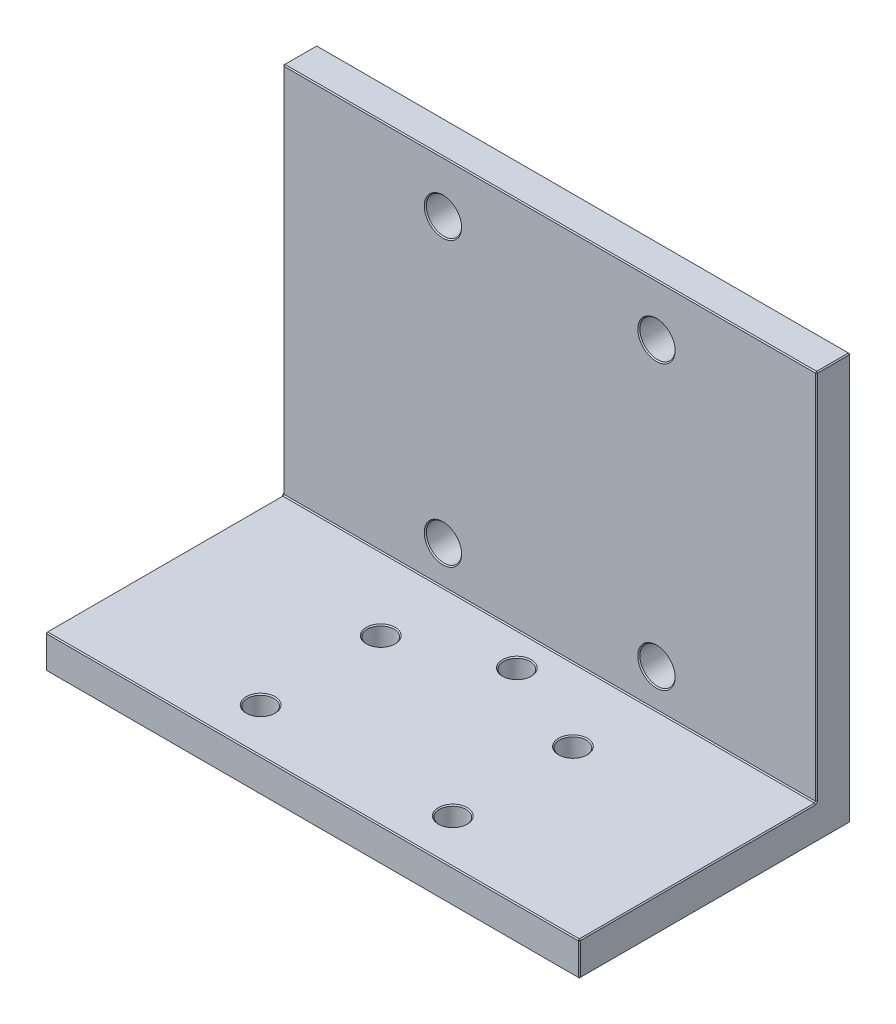
from build123d import *

# Parameters (mm, degrees)
BOSS_EXTRUDE1_DEPTH = 50
SKETCH2_R           = 3.3
CUT_EXTRUDE1_DEPTH  = 100
SKETCH3_R           = 2.5
CUT_EXTRUDE2_DEPTH  = 100
CHAMFER1_SIZE       = 0.2


with BuildPart() as part:
    # Sketch1 → Boss-Extrude1 (new, symmetric)
    with BuildSketch(Plane(origin=(0, 0, 0), x_dir=(0, 0, -1), z_dir=(1, 0, 0))):
        Polygon((0, 0), (0, 76.2), (-6.35, 76.2), (-6.35, 6.35), (-50.8, 6.35), (-50.8, 0), align=None)
    extrude(amount=BOSS_EXTRUDE1_DEPTH, both=True)

    # Sketch2 → Cut-Extrude1 (cut)
    with BuildSketch(Plane.XY.offset(6.35)):
        with Locations((-20, 66.5)):
            Circle(SKETCH2_R)
        with Locations((20, 66.5)):
            Circle(SKETCH2_R)
        with Locations((20, 13.5)):
            Circle(SKETCH2_R)
        with Locations((-20, 13.5)):
            Circle(SKETCH2_R)
    extrude(amount=-CUT_EXTRUDE1_DEPTH, mode=Mode.SUBTRACT)

    # Sketch3 → Cut-Extrude2 (cut)
    with BuildSketch(Plane(origin=(0, 6.35, 0), x_dir=(1, 0, 0), z_dir=(0, 1, 0))):
        with Locations(Location((-18, -20, 0), (0, 0, 270))):
            Circle(SKETCH3_R)
        with Locations(Location((-18, -42.5, 0), (0, 0, 270))):
            Circle(SKETCH3_R)
        with Locations(Location((18, -42.5, 0), (0, 0, 270))):
            Circle(SKETCH3_R)
        with Locations(Location((18, -20, 0), (0, 0, 270))):
            Circle(SKETCH3_R)
        with Locations(Location((0, -12.5, 0), (0, 0, 270))):
            Circle(SKETCH3_R)
    extrude(amount=-CUT_EXTRUDE2_DEPTH, mode=Mode.SUBTRACT)

    # Chamfer1
    chamfer1_edges = [part.edges().sort_by_distance(p)[0] for p in [
        (50, 76.2, 3.175),
        (0, 0, 50.8),
        (0, 6.35, 50.8),
        (0, 6.35, 6.35),
        (0, 76.2, 6.35),
        (0, 76.2, 0),
        (0, 0, 0),
        (50, 41.275, 6.35),
        (50, 6.35, 28.575),
        (50, 3.175, 50.8),
        (-23.3, 66.5, 0),
        (-23.3, 66.5, 6.35),
        (16.7, 66.5, 0),
        (16.7, 66.5, 6.35),
        (16.7, 13.5, 0),
        (16.7, 13.5, 6.35),
        (-23.3, 13.5, 0),
        (-23.3, 13.5, 6.35),
        (-18, 0, 17.5),
        (50, 0, 25.4),
        (-18, 6.35, 17.5),
        (-18, 0, 40),
        (-18, 6.35, 40),
        (18, 0, 40),
        (18, 6.35, 40),
        (18, 0, 17.5),
        (18, 6.35, 17.5),
        (0, 0, 10),
        (0, 6.35, 10),
        (-50, 3.175, 50.8),
        (-50, 6.35, 28.575),
        (-50, 41.275, 6.35),
        (50, 38.1, 0),
        (-50, 76.2, 3.175),
        (-50, 38.1, 0),
        (-50, 0, 25.4),
    ]]
    chamfer(chamfer1_edges, length=CHAMFER1_SIZE)


solid = part.part
